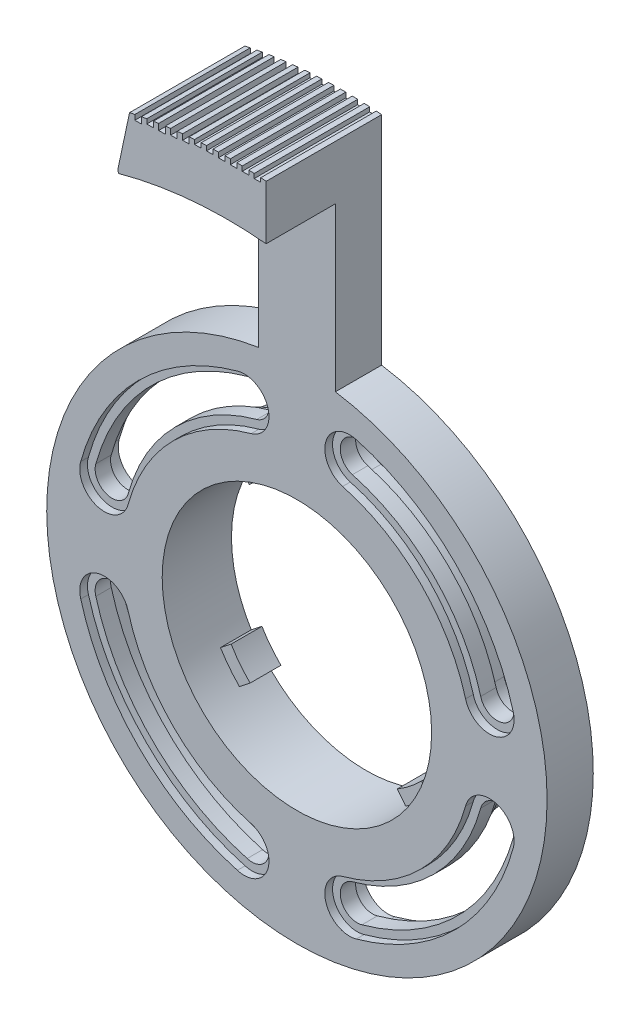
from build123d import *

# Parameters (mm, degrees)
SKETCH1_R            = 32.5
BOSS_EXTRUDE1_DEPTH  = 5
BOSS_EXTRUDE3_DEPTH  = 5
SKETCH4_R            = 17.5
CUT_EXTRUDE1_DEPTH   = 5
BOSS_EXTRUDE4_START  = 4
SKETCH5_R            = 21.5
SKETCH5_R_2          = 17.5
BOSS_EXTRUDE4_DEPTH  = 4
BOSS_EXTRUDE5_START  = 1
SKETCH7_R            = 32.5
SKETCH7_R_2          = 30.5
BOSS_EXTRUDE5_DEPTH  = 1
CUT_EXTRUDE2_DEPTH   = 2
CUT_EXTRUDE3_DEPTH   = 3
BOSS_EXTRUDE6_DEPTH  = 9
CUT_EXTRUDE4_START   = -5
CUT_EXTRUDE4_DEPTH   = 5
BOSS_EXTRUDE7_START  = 1
BOSS_EXTRUDE7_DEPTH  = 1
BOSS_EXTRUDE8_DEPTH  = 15
CUT_EXTRUDE5_START   = -15
CUT_EXTRUDE5_DEPTH   = 15
SKETCH18_W           = 0.85
SKETCH18_H           = 0.69898918
SKETCH18_H_2         = 0.780673019
SKETCH18_H_3         = 0.988368058
SKETCH18_H_4         = 0.852278475
SKETCH18_H_5         = 1.144073954
SKETCH18_H_6         = 1.181643707
SKETCH18_H_7         = 1.152767053
SKETCH18_H_8         = 1.339263178
SKETCH18_H_9         = 1.325555487
CUT_EXTRUDE6_DEPTH   = 15
CHAMFER1_SIZE        = 0.5
CHAMFER1_SIZE2       = 0.172496987
BOSS_EXTRUDE10_DEPTH = 4
CUT_EXTRUDE7_START   = -1
CUT_EXTRUDE7_DEPTH   = 1


with BuildPart() as part:
    # Sketch1 → Boss-Extrude1 (new body)
    with BuildSketch(Plane.XY):
        Circle(SKETCH1_R)
    extrude(amount=BOSS_EXTRUDE1_DEPTH)

    # Sketch3 → Boss-Extrude3 (add)
    with BuildSketch(Plane(origin=(0, 0, 0), x_dir=(-1, 0, 0), z_dir=(0, 0, -1))):
        with BuildLine():
            Line((5, 32.113081447), (5, 63.499625434))
            Line((5, 63.499625434), (-5, 63.499625434))
            Line((-5, 63.499625434), (-5, 32.113081447))
            ThreePointArc((-5, 32.113081447), (0, 32.5), (5, 32.113081447))
        make_face()
    extrude(amount=-BOSS_EXTRUDE3_DEPTH)

    # Sketch4 → Cut-Extrude1 (cut)
    with BuildSketch(Plane(origin=(0, 0, 0), x_dir=(-1, 0, 0), z_dir=(0, 0, -1))):
        Circle(SKETCH4_R)
    extrude(amount=-CUT_EXTRUDE1_DEPTH, mode=Mode.SUBTRACT)

    # Sketch5 → Boss-Extrude4 (add)
    with BuildSketch(Plane(origin=(0, 0, 0), x_dir=(-1, 0, 0), z_dir=(0, 0, -1)).offset(BOSS_EXTRUDE4_START)):
        with Locations(Location((0, 0, 0), (0, 0, 180))):
            Circle(SKETCH5_R)
        Circle(SKETCH5_R_2, mode=Mode.SUBTRACT)
    extrude(amount=-BOSS_EXTRUDE4_DEPTH)

    # Sketch7 → Boss-Extrude5 (add)
    with BuildSketch(Plane(origin=(0, 0, 0), x_dir=(-1, 0, 0), z_dir=(0, 0, -1)).offset(BOSS_EXTRUDE5_START)):
        Circle(SKETCH7_R)
        Circle(SKETCH7_R_2, mode=Mode.SUBTRACT)
    extrude(amount=-BOSS_EXTRUDE5_DEPTH)

    # Sketch8 → Cut-Extrude2 (cut)
    with BuildSketch(Plane(origin=(0, 0, 0), x_dir=(-1, 0, 0), z_dir=(0, 0, -1))):
        with BuildLine():
            ThreePointArc((-5.939758542, 21.935800032), (-3.755820085, 25.904816954), (-7.729379949, 28.080478812))
            ThreePointArc((-7.729379949, 28.080478812), (-20.594375503, 20.594375503), (-28.080478812, 7.729379949))
            ThreePointArc((-28.080478812, 7.729379949), (-25.859245418, 3.742912586), (-21.910851343, 6.031139859))
            ThreePointArc((-21.910851343, 6.031139859), (-16.069537246, 16.069537246), (-6.031139859, 21.910851343))
            ThreePointArc((-6.031139859, 21.910851343), (-5.9854622, 21.9233733), (-5.939758542, 21.935800032))
        make_face()
        with BuildLine():
            ThreePointArc((-21.910851343, -6.031139859), (-25.859245418, -3.742912586), (-28.080478812, -7.729379949))
            ThreePointArc((-28.080478812, -7.729379949), (-20.594375503, -20.594375503), (-7.729379949, -28.080478812))
            ThreePointArc((-7.729379949, -28.080478812), (-3.755820085, -25.904816954), (-5.939758542, -21.935800032))
            ThreePointArc((-5.939758542, -21.935800032), (-5.9854622, -21.9233733), (-6.031139859, -21.910851343))
            ThreePointArc((-6.031139859, -21.910851343), (-16.069537246, -16.069537246), (-21.910851343, -6.031139859))
        make_face()
        with BuildLine():
            ThreePointArc((7.729379949, -28.080478812), (20.594375503, -20.594375503), (28.080478812, -7.729379949))
            ThreePointArc((28.080478812, -7.729379949), (25.859245418, -3.742912586), (21.910851343, -6.031139859))
            ThreePointArc((21.910851343, -6.031139859), (16.069537246, -16.069537246), (6.031139859, -21.910851343))
            ThreePointArc((6.031139859, -21.910851343), (5.9854622, -21.9233733), (5.939758542, -21.935800032))
            ThreePointArc((5.939758542, -21.935800032), (3.755820085, -25.904816954), (7.729379949, -28.080478812))
        make_face()
        with BuildLine():
            ThreePointArc((21.910851343, 6.031139859), (25.859245418, 3.742912586), (28.080478812, 7.729379949))
            ThreePointArc((28.080478812, 7.729379949), (20.594375503, 20.594375503), (7.729379949, 28.080478812))
            ThreePointArc((7.729379949, 28.080478812), (3.755820085, 25.904816954), (5.939758542, 21.935800032))
            ThreePointArc((5.939758542, 21.935800032), (5.9854622, 21.9233733), (6.031139859, 21.910851343))
            ThreePointArc((6.031139859, 21.910851343), (16.069537246, 16.069537246), (21.910851343, 6.031139859))
        make_face()
    extrude(amount=-CUT_EXTRUDE2_DEPTH, mode=Mode.SUBTRACT)

    # Sketch9 → Cut-Extrude3 (cut)
    with BuildSketch(Plane(origin=(0, 0, 2), x_dir=(-1, 0, 0), z_dir=(0, 0, -1))):
        with BuildLine():
            ThreePointArc((22.877465161, 6.287539855), (16.748247082, 16.804992987), (6.210122463, 22.898601455))
            ThreePointArc((6.210122463, 22.898601455), (4.718079036, 25.632525296), (7.45516164, 27.118766184))
            ThreePointArc((7.45516164, 27.118766184), (19.887268722, 19.887268722), (27.118766184, 7.45516164))
            ThreePointArc((27.118766184, 7.45516164), (25.593936237, 4.707075979), (22.877465161, 6.287539855))
        make_face()
        with BuildLine():
            ThreePointArc((6.210122463, -22.898601455), (4.718079036, -25.632525296), (7.45516164, -27.118766184))
            ThreePointArc((7.45516164, -27.118766184), (19.887268722, -19.887268722), (27.118766184, -7.45516164))
            ThreePointArc((27.118766184, -7.45516164), (25.593936237, -4.707075979), (22.877465161, -6.287539855))
            ThreePointArc((22.877465161, -6.287539855), (16.748247082, -16.804992987), (6.210122463, -22.898601455))
        make_face()
        with BuildLine():
            ThreePointArc((-22.877465161, -6.287539855), (-16.748247082, -16.804992987), (-6.210122463, -22.898601455))
            ThreePointArc((-6.210122463, -22.898601455), (-4.718079036, -25.632525296), (-7.45516164, -27.118766184))
            ThreePointArc((-7.45516164, -27.118766184), (-19.887268722, -19.887268722), (-27.118766184, -7.45516164))
            ThreePointArc((-27.118766184, -7.45516164), (-25.593936237, -4.707075979), (-22.877465161, -6.287539855))
        make_face()
        with BuildLine():
            ThreePointArc((-7.45516164, 27.118766184), (-19.887268722, 19.887268722), (-27.118766184, 7.45516164))
            ThreePointArc((-27.118766184, 7.45516164), (-25.593936237, 4.707075979), (-22.877465161, 6.287539855))
            ThreePointArc((-22.877465161, 6.287539855), (-16.748247082, 16.804992987), (-6.210122463, 22.898601455))
            ThreePointArc((-6.210122463, 22.898601455), (-4.718079036, 25.632525296), (-7.45516164, 27.118766184))
        make_face()
    extrude(amount=-CUT_EXTRUDE3_DEPTH, mode=Mode.SUBTRACT)

    # Sketch11 → Boss-Extrude6 (add)
    with BuildSketch(Plane.XY.offset(5)):
        with BuildLine():
            Line((-5, 53.265842714), (-5, 60.293034424))
            ThreePointArc((-5, 60.293034424), (0, 60.5), (5, 60.293034424))
            Line((5, 60.293034424), (5, 53.265842714))
            ThreePointArc((5, 53.265842714), (0, 53.5), (-5, 53.265842714))
        make_face()
    extrude(amount=BOSS_EXTRUDE6_DEPTH)

    # Sketch12 → Cut-Extrude4 (cut)
    with BuildSketch(Plane.XY.offset(5).offset(CUT_EXTRUDE4_START)):
        with BuildLine():
            Line((-5, 60.293034424), (-5, 63.499625434))
            Line((-5, 63.499625434), (5, 63.499625434))
            Line((5, 63.499625434), (5, 60.293034424))
            ThreePointArc((5, 60.293034424), (0, 60.5), (-5, 60.293034424))
        make_face()
    extrude(amount=CUT_EXTRUDE4_DEPTH, mode=Mode.SUBTRACT)

    # Sketch14 → Boss-Extrude7 (add)
    with BuildSketch(Plane(origin=(0, 0, 0), x_dir=(-1, 0, 0), z_dir=(0, 0, -1)).offset(BOSS_EXTRUDE7_START)):
        with BuildLine():
            Line((5, 32.113081447), (5, 60.293034424))
            ThreePointArc((5, 60.293034424), (0, 60.5), (-5, 60.293034424))
            Line((-5, 60.293034424), (-5, 32.113081447))
            ThreePointArc((-5, 32.113081447), (0, 32.5), (5, 32.113081447))
        make_face()
    extrude(amount=-BOSS_EXTRUDE7_DEPTH)

    # Sketch15 → Boss-Extrude8 (add)
    with BuildSketch(Plane(origin=(0, 0, -1), x_dir=(-1, 0, 0), z_dir=(0, 0, -1))):
        with BuildLine():
            Line((5, 60.293034424), (5, 53.265842714))
            ThreePointArc((5, 53.265842714), (9.716196108, 52.610317745), (14.355429085, 51.538060264))
            Line((14.355429085, 51.538060264), (16.233709526, 58.281357869))
            ThreePointArc((16.233709526, 58.281357869), (10.664394765, 59.552671513), (5, 60.293034424))
        make_face()
    extrude(amount=-BOSS_EXTRUDE8_DEPTH)

    # Sketch16 → Cut-Extrude5 (cut)
    with BuildSketch(Plane.XY.offset(14).offset(CUT_EXTRUDE5_START)):
        with BuildLine():
            Line((-14.355429085, 51.538060264), (-12.744080385, 59.142526283))
            ThreePointArc((-12.744080385, 59.142526283), (-14.495291642, 58.737862748), (-16.233709526, 58.281357869))
            Line((-16.233709526, 58.281357869), (-14.355429085, 51.538060264))
        make_face()
    extrude(amount=CUT_EXTRUDE5_DEPTH, mode=Mode.SUBTRACT)

    # Sketch18 → Cut-Extrude6 (cut)
    with BuildSketch(Plane(origin=(0, 0, -1), x_dir=(-1, 0, 0), z_dir=(0, 0, -1))):
        with Locations((-3.875, 60.17178764)):
            Rectangle(SKETCH18_W, SKETCH18_H)
        with Locations((-2.325, 60.255908678)):
            Rectangle(SKETCH18_W, SKETCH18_H_2)
        with Locations((-0.775, 60.33469226)):
            Rectangle(SKETCH18_W, SKETCH18_H_3)
        with Locations((0.775, 60.33469226)):
            Rectangle(SKETCH18_W, SKETCH18_H_3)
        with Locations((2.325, 60.33469226)):
            Rectangle(SKETCH18_W, SKETCH18_H_3)
        with Locations((3.875, 60.22010595)):
            Rectangle(SKETCH18_W, SKETCH18_H_4)
        with Locations((6.975, 59.861138591)):
            Rectangle(SKETCH18_W, SKETCH18_H_5)
        with Locations((8.525, 59.629284097)):
            Rectangle(SKETCH18_W, SKETCH18_H_6)
        with Locations((10.075, 59.564717895)):
            Rectangle(SKETCH18_W, SKETCH18_H_7)
        with Locations((5.425, 60.1592447)):
            Rectangle(SKETCH18_W, SKETCH18_H_8)
        with Locations((11.625, 59.300216993)):
            Rectangle(SKETCH18_W, SKETCH18_H_9)
    extrude(amount=-CUT_EXTRUDE6_DEPTH, mode=Mode.SUBTRACT)

    # Chamfer1
    chamfer1_edges = [part.edges().sort_by_distance(p)[0] for p in [
        (-14.355429085, 51.538060264, 6.5),
    ]]
    chamfer1_side = [part.faces().sort_by_distance(p)[0] for p in [
        (-13.549754735, 55.340293274, 6.5),
    ]]
    chamfer(chamfer1_edges, length=CHAMFER1_SIZE, length2=CHAMFER1_SIZE2, reference=chamfer1_side[0])

    # Sketch19 → Boss-Extrude10 (add)
    with BuildSketch(Plane(origin=(0, 0, -4), x_dir=(-1, 0, 0), z_dir=(0, 0, -1))):
        with BuildLine():
            ThreePointArc((-12.468510861, 12.27950475), (-13.790188188, 10.774075818), (-14.931156763, 9.127461736))
            Line((-14.931156763, 9.127461736), (-13.542020791, 8.042149768))
            ThreePointArc((-13.542020791, 8.042149768), (-12.411169369, 9.696668236), (-11.07937489, 11.194192782))
            Line((-11.07937489, 11.194192782), (-12.468510861, 12.27950475))
        make_face()
        with BuildLine():
            ThreePointArc((12.27950475, 12.468510861), (10.774075818, 13.790188188), (9.127461736, 14.931156763))
            Line((9.127461736, 14.931156763), (8.042149768, 13.542020791))
            ThreePointArc((8.042149768, 13.542020791), (9.696668236, 12.411169369), (11.194192782, 11.07937489))
            Line((11.194192782, 11.07937489), (12.27950475, 12.468510861))
        make_face()
        with BuildLine():
            Line((11.07937489, -11.194192782), (12.468510861, -12.27950475))
            ThreePointArc((12.468510861, -12.27950475), (13.790188188, -10.774075818), (14.931156763, -9.127461736))
            Line((14.931156763, -9.127461736), (13.542020791, -8.042149768))
            ThreePointArc((13.542020791, -8.042149768), (12.411169369, -9.696668236), (11.07937489, -11.194192782))
        make_face()
        with BuildLine():
            Line((-11.194192782, -11.07937489), (-12.27950475, -12.468510861))
            ThreePointArc((-12.27950475, -12.468510861), (-10.774075818, -13.790188188), (-9.127461736, -14.931156763))
            Line((-9.127461736, -14.931156763), (-8.042149768, -13.542020791))
            ThreePointArc((-8.042149768, -13.542020791), (-9.696668236, -12.411169369), (-11.194192782, -11.07937489))
        make_face()
    extrude(amount=-BOSS_EXTRUDE10_DEPTH)

    # Sketch20 → Cut-Extrude7 (cut)
    with BuildSketch(Plane.XY.offset(5).offset(CUT_EXTRUDE7_START)):
        with BuildLine():
            ThreePointArc((-28.080478812, 7.729379949), (-25.859245418, 3.742912586), (-21.910851343, 6.031139859))
            ThreePointArc((-21.910851343, 6.031139859), (-16.03601171, 16.102992984), (-5.939758542, 21.935800032))
            ThreePointArc((-5.939758542, 21.935800032), (-3.755820085, 25.904816954), (-7.729379949, 28.080478812))
            ThreePointArc((-7.729379949, 28.080478812), (-20.594375503, 20.594375503), (-28.080478812, 7.729379949))
        make_face()
        with BuildLine():
            ThreePointArc((5.939758542, -21.935800032), (3.755820085, -25.904816954), (7.729379949, -28.080478812))
            ThreePointArc((7.729379949, -28.080478812), (20.594375503, -20.594375503), (28.080478812, -7.729379949))
            ThreePointArc((28.080478812, -7.729379949), (25.859245418, -3.742912586), (21.910851343, -6.031139859))
            ThreePointArc((21.910851343, -6.031139859), (16.03601171, -16.102992984), (5.939758542, -21.935800032))
        make_face()
        with BuildLine():
            ThreePointArc((21.910851343, 6.031139859), (25.859245418, 3.742912586), (28.080478812, 7.729379949))
            ThreePointArc((28.080478812, 7.729379949), (20.594375503, 20.594375503), (7.729379949, 28.080478812))
            ThreePointArc((7.729379949, 28.080478812), (3.755820085, 25.904816954), (5.939758542, 21.935800032))
            ThreePointArc((5.939758542, 21.935800032), (16.03601171, 16.102992984), (21.910851343, 6.031139859))
        make_face()
        with BuildLine():
            ThreePointArc((-7.729379949, -28.080478812), (-3.755820085, -25.904816954), (-5.939758542, -21.935800032))
            ThreePointArc((-5.939758542, -21.935800032), (-16.03601171, -16.102992984), (-21.910851343, -6.031139859))
            ThreePointArc((-21.910851343, -6.031139859), (-25.859245418, -3.742912586), (-28.080478812, -7.729379949))
            ThreePointArc((-28.080478812, -7.729379949), (-20.594375503, -20.594375503), (-7.729379949, -28.080478812))
        make_face()
    extrude(amount=CUT_EXTRUDE7_DEPTH, mode=Mode.SUBTRACT)


solid = part.part
